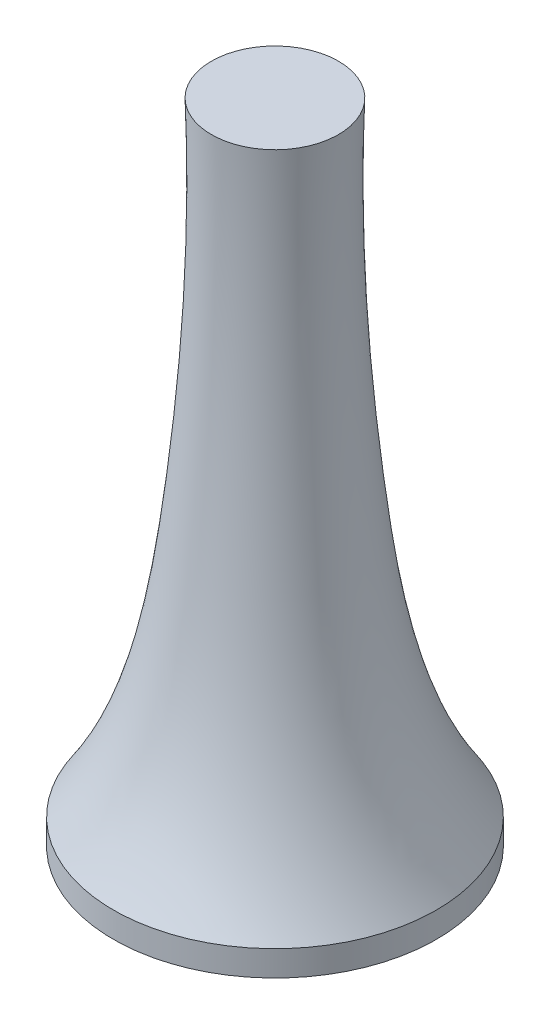
from build123d import *


with BuildPart() as part:
    # Sketch1 → Revolve1 (revolve)
    with BuildSketch(Plane.XY, mode=Mode.PRIVATE) as revolve1_sk:
        with BuildLine():
            Line((2.54, 0.4), (2.54, 0))
            Line((2.54, 0), (0, 0))
            Line((0, 0), (0, 10.192000012))
            Line((0, 10.192000012), (1, 10.192000012))
            add(Edge.make_bspline(
                [(1, 10.192000012), (0.936252723, 8.338730602), (1.107416255, 5.014306497), (1.681413548, 1.672710351), (2.54, 0.4)],
                knots=[0, 0, 0, 0, 0.552959232, 1, 1, 1, 1], degree=3))
        make_face()
    revolve(revolve1_sk.sketch.rotate(Axis((0, 0, 0), (0, 1, 0)), 90), axis=Axis((0, 0, 0), (0, 1, 0)))


solid = part.part
